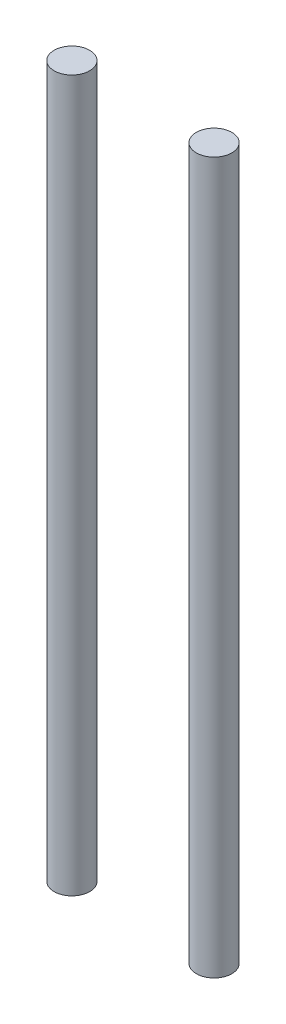
from build123d import *

# Parameters (mm, degrees)
SKETCH_1_R        = 12.5
EXTRUDE_1_DEPTH   = 500
EXTRUDE_1_2_DEPTH = 500


with BuildPart() as part:
    # 草图1 → 凸台-拉伸1 (new body)
    with BuildSketch(Plane(origin=(0, 0, 0), x_dir=(1, 0, 0), z_dir=(0, 1, 0))):
        with Locations(Location((-50, 0, 0), (0, 0, 270))):
            Circle(SKETCH_1_R)
    extrude(amount=EXTRUDE_1_DEPTH)


with BuildPart() as body_2:
    # 草图1 → Extrude 1 2 (new body)
    with BuildSketch(Plane(origin=(0, 0, 0), x_dir=(1, 0, 0), z_dir=(0, 1, 0))):
        with Locations(Location((50, 0, 0), (0, 0, 270))):
            Circle(SKETCH_1_R)
    extrude(amount=EXTRUDE_1_2_DEPTH)


solid = Compound([part.part, body_2.part])
